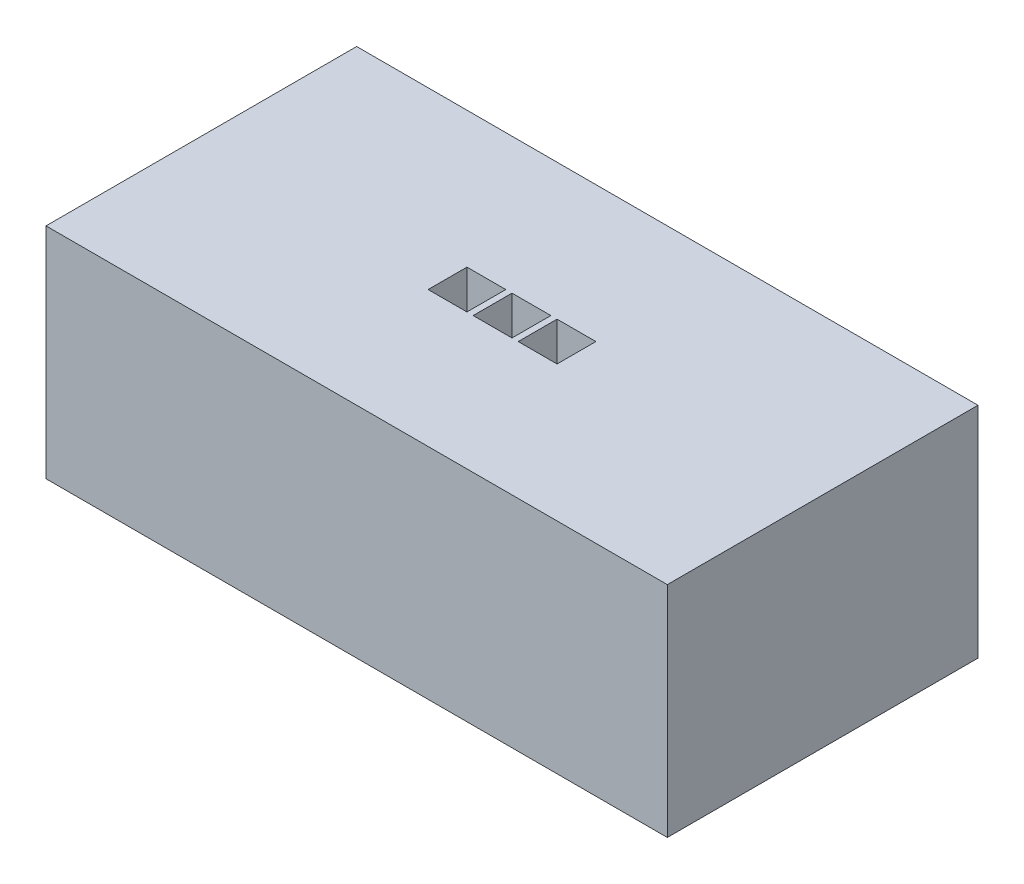
from build123d import *

# Parameters (mm, degrees)
ESQUISSE1_W             = 40
ESQUISSE1_H             = 20
BOSS_EXTRU_2_DEPTH      = 14.1
ESQUISSE2_W             = 2.5
ESQUISSE2_H             = 2.5
ENL_V_MAT_EXTRU_1_DEPTH = 27.435014659


with BuildPart() as part:
    # Esquisse1 → Boss.-Extru.2 (new body)
    with BuildSketch(Plane(origin=(0, 0, 0), x_dir=(1, 0, 0), z_dir=(0, 1, 0))):
        Rectangle(ESQUISSE1_W, ESQUISSE1_H)
    extrude(amount=BOSS_EXTRU_2_DEPTH)

    # Esquisse2 → Enlèv. mat.-Extru.1 (cut, through all)
    with BuildSketch(Plane(origin=(0, 14.1, 0), x_dir=(1, 0, 0), z_dir=(0, 1, 0))):
        with Locations((-2.9, 0)):
            Rectangle(ESQUISSE2_W, ESQUISSE2_H)
        Rectangle(ESQUISSE2_W, ESQUISSE2_H)
        with Locations((2.9, 0)):
            Rectangle(ESQUISSE2_W, ESQUISSE2_H)
    extrude(amount=-ENL_V_MAT_EXTRU_1_DEPTH, mode=Mode.SUBTRACT)


solid = part.part
